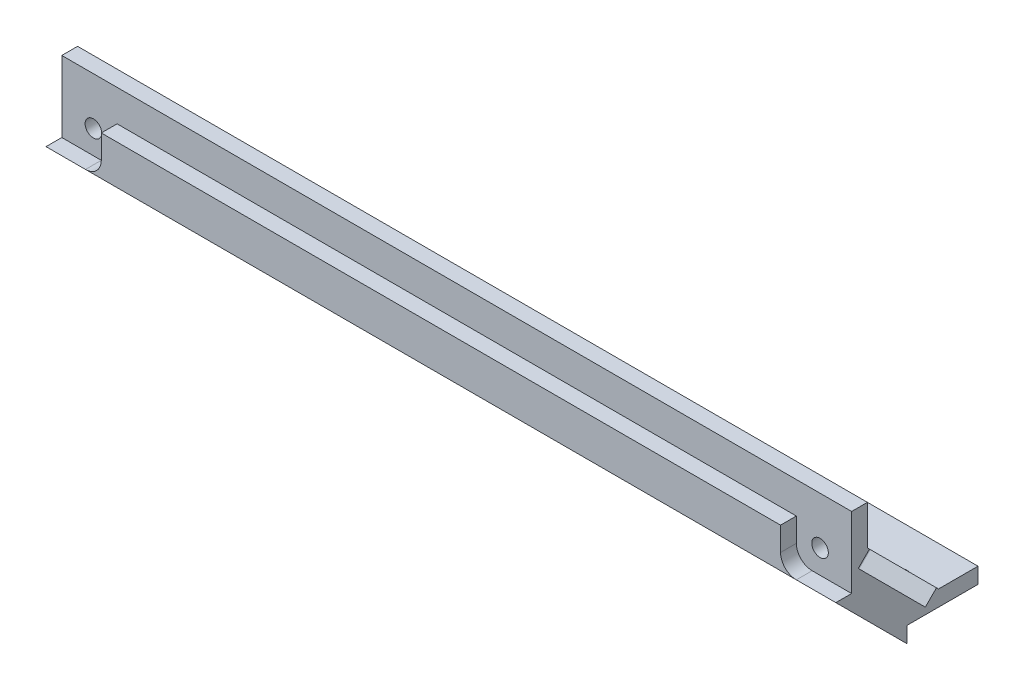
from build123d import *

# Parameters (mm, degrees)
BOSS_EXTRUDE3_DEPTH = 200
CHAMFER2_SIZE       = 18
CHAMFER3_SIZE       = 18
SKETCH6_W           = 200
SKETCH6_H           = 8
CUT_EXTRUDE2_DEPTH  = 4
SKETCH7_W           = 200
SKETCH7_H           = 8
CUT_EXTRUDE3_DEPTH  = 4
SKETCH8_R           = 1.4
CUT_EXTRUDE4_DEPTH  = 3
SKETCH9_R           = 2.1
CUT_EXTRUDE5_DEPTH  = 6
SKETCH10_R          = 2.1
CUT_EXTRUDE6_DEPTH  = 6
CUT_EXTRUDE7_DEPTH  = 4
SKETCH12_W          = 4
SKETCH12_H          = 10
SKETCH12_W_2        = 10
SKETCH12_H_2        = 4
CUT_EXTRUDE8_DEPTH  = 14
FILLET1_R           = 4
FILLET2_R           = 4
SKETCH13_W          = 4
SKETCH13_H          = 10
SKETCH13_W_2        = 10
SKETCH13_H_2        = 4
CUT_EXTRUDE9_DEPTH  = 14
FILLET3_R           = 4
SKETCH14_R          = 2.1
CUT_EXTRUDE10_DEPTH = 4
SKETCH15_R          = 2.1
CUT_EXTRUDE11_DEPTH = 4
SKETCH16_R          = 2.1
CUT_EXTRUDE12_DEPTH = 4


with BuildPart() as part:
    # Sketch5 → Boss-Extrude3 (new body)
    with BuildSketch(Plane(origin=(0, 0, 0), x_dir=(0, 0, -1), z_dir=(1, 0, 0))):
        Polygon((0, 0), (0, 36), (8, 36), (8, 8), (36, 8), (36, 0), align=None)
    extrude(amount=BOSS_EXTRUDE3_DEPTH)

    # Chamfer2
    chamfer2_edges = [part.edges().sort_by_distance(p)[0] for p in [
        (100, 8, -8),
    ]]
    chamfer(chamfer2_edges, length=CHAMFER2_SIZE)

    # Chamfer3
    chamfer3_edges = [part.edges().sort_by_distance(p)[0] for p in [
        (100, 0, 0),
    ]]
    chamfer(chamfer3_edges, length=CHAMFER3_SIZE)

    # Sketch6 → Cut-Extrude2 (cut)
    with BuildSketch(Plane(origin=(0, 0, 0), x_dir=(-1, 0, 0), z_dir=(0, -1, 0))):
        with Locations((-100, 32)):
            Rectangle(SKETCH6_W, SKETCH6_H)
    extrude(amount=-CUT_EXTRUDE2_DEPTH, mode=Mode.SUBTRACT)

    # Sketch7 → Cut-Extrude3 (cut)
    with BuildSketch(Plane.XY):
        with Locations((100, 32)):
            Rectangle(SKETCH7_W, SKETCH7_H)
    extrude(amount=-CUT_EXTRUDE3_DEPTH, mode=Mode.SUBTRACT)

    # Sketch8 → Cut-Extrude4 (cut)
    with BuildSketch(Plane(origin=(0, 17, -17), x_dir=(-1, 0, 0), z_dir=(0, 0.7071067811865438, -0.7071067811865512))):
        with Locations(Location((-182.5, 0, 0), (0, 0, 90))):
            Circle(SKETCH8_R)
        with Locations(Location((-167.5, 0, 0), (0, 0, 90))):
            Circle(SKETCH8_R)
        with Locations(Location((-152.5, 0, 0), (0, 0, 90))):
            Circle(SKETCH8_R)
        with Locations(Location((-137.5, 0, 0), (0, 0, 90))):
            Circle(SKETCH8_R)
        with Locations(Location((-122.5, 0, 0), (0, 0, 90))):
            Circle(SKETCH8_R)
        with Locations(Location((-107.5, 0, 0), (0, 0, 90))):
            Circle(SKETCH8_R)
        with Locations(Location((-92.5, 0, 0), (0, 0, 90))):
            Circle(SKETCH8_R)
        with Locations(Location((-77.5, 0, 0), (0, 0, 90))):
            Circle(SKETCH8_R)
        with Locations(Location((-62.5, 0, 0), (0, 0, 90))):
            Circle(SKETCH8_R)
        with Locations(Location((-47.5, 0, 0), (0, 0, 90))):
            Circle(SKETCH8_R)
        with Locations(Location((-32.5, 0, 0), (0, 0, 90))):
            Circle(SKETCH8_R)
        with Locations(Location((-17.5, 0, 0), (0, 0, 90))):
            Circle(SKETCH8_R)
    extrude(amount=-CUT_EXTRUDE4_DEPTH, mode=Mode.SUBTRACT)

    # Sketch9 → Cut-Extrude5 (cut)
    with BuildSketch(Plane(origin=(0, 17, -17), x_dir=(-1, 0, 0), z_dir=(0, 0.7071067811865438, -0.7071067811865512))):
        with Locations(Location((-73, -10, 0), (0, 0, 90))):
            Circle(SKETCH9_R)
        with Locations(Location((-127, -10, 0), (0, 0, 90))):
            Circle(SKETCH9_R)
        with Locations(Location((-127, 10, 0), (0, 0, 90))):
            Circle(SKETCH9_R)
        with Locations(Location((-73, 10, 0), (0, 0, 90))):
            Circle(SKETCH9_R)
    extrude(amount=-CUT_EXTRUDE5_DEPTH, mode=Mode.SUBTRACT)

    # Sketch10 → Cut-Extrude6 (cut)
    with BuildSketch(Plane(origin=(0, 17, -17), x_dir=(-1, 0, 0), z_dir=(0, 0.7071067811865438, -0.7071067811865512))):
        with Locations(Location((-89, -10, 0), (0, 0, 90))):
            Circle(SKETCH10_R)
        with Locations(Location((-111, -10, 0), (0, 0, 90))):
            Circle(SKETCH10_R)
        with Locations(Location((-111, 10, 0), (0, 0, 90))):
            Circle(SKETCH10_R)
        with Locations(Location((-89, 10, 0), (0, 0, 90))):
            Circle(SKETCH10_R)
    extrude(amount=-CUT_EXTRUDE6_DEPTH, mode=Mode.SUBTRACT)

    # Sketch11 → Cut-Extrude7 (cut)
    with BuildSketch(Plane(origin=(0, 17, -17), x_dir=(-1, 0, 0), z_dir=(0, 0.7071067811865438, -0.7071067811865512))):
        Polygon((0, -12), (-14, 0), (0, 12), align=None)
        Polygon((-200, 12), (-186, 0), (-200, -12), align=None)
    extrude(amount=-CUT_EXTRUDE7_DEPTH, mode=Mode.SUBTRACT)

    # Sketch12 → Cut-Extrude8 (cut)
    with BuildSketch(Plane(origin=(200, 0, 0), x_dir=(0, 0, -1), z_dir=(1, 0, 0))):
        with Locations((2, 23)):
            Rectangle(SKETCH12_W, SKETCH12_H)
        with Locations((23, 2)):
            Rectangle(SKETCH12_W_2, SKETCH12_H_2)
    extrude(amount=-CUT_EXTRUDE8_DEPTH, mode=Mode.SUBTRACT)

    # Fillet1
    fillet1_edges = [part.edges().sort_by_distance(p)[0] for p in [
        (14, 15.585786438, -15.585786438),
        (186, 15.585786438, -15.585786438),
    ]]
    fillet(fillet1_edges, radius=FILLET1_R)

    # Fillet2
    fillet2_edges = [part.edges().sort_by_distance(p)[0] for p in [
        (186, 18, -2),
        (186, 2, -18),
    ]]
    fillet(fillet2_edges, radius=FILLET2_R)

    # Sketch13 → Cut-Extrude9 (cut)
    with BuildSketch(Plane.ZY):
        with Locations((-2, 23)):
            Rectangle(SKETCH13_W, SKETCH13_H)
        with Locations((-23, 2)):
            Rectangle(SKETCH13_W_2, SKETCH13_H_2)
    extrude(amount=-CUT_EXTRUDE9_DEPTH, mode=Mode.SUBTRACT)

    # Fillet3
    fillet3_edges = [part.edges().sort_by_distance(p)[0] for p in [
        (14, 18, -2),
        (14, 2, -18),
    ]]
    fillet(fillet3_edges, radius=FILLET3_R)

    # Sketch14 → Cut-Extrude10 (cut)
    with BuildSketch(Plane.XY.offset(-4)):
        with Locations((192, 24)):
            Circle(SKETCH14_R)
        with Locations((8, 24)):
            Circle(SKETCH14_R)
    extrude(amount=-CUT_EXTRUDE10_DEPTH, mode=Mode.SUBTRACT)

    # Sketch15 → Cut-Extrude11 (cut)
    with BuildSketch(Plane(origin=(0, 4, 0), x_dir=(-1, 0, 0), z_dir=(0, -1, 0))):
        with Locations(Location((-8, 24, 0), (0, 0, 90))):
            Circle(SKETCH15_R)
        with Locations(Location((-192, 24, 0), (0, 0, 90))):
            Circle(SKETCH15_R)
    extrude(amount=-CUT_EXTRUDE11_DEPTH, mode=Mode.SUBTRACT)

    # Sketch16 → Cut-Extrude12 (cut)
    with BuildSketch(Plane(origin=(0, 14.171572875, -14.171572875), x_dir=(-1, 0, 0), z_dir=(0, 0.7071067811865438, -0.7071067811865513))):
        with Locations(Location((-6, 0, 0), (0, 0, 90))):
            Circle(SKETCH16_R)
        with Locations(Location((-194, 0, 0), (0, 0, 90))):
            Circle(SKETCH16_R)
    extrude(amount=-CUT_EXTRUDE12_DEPTH, mode=Mode.SUBTRACT)


solid = part.part
